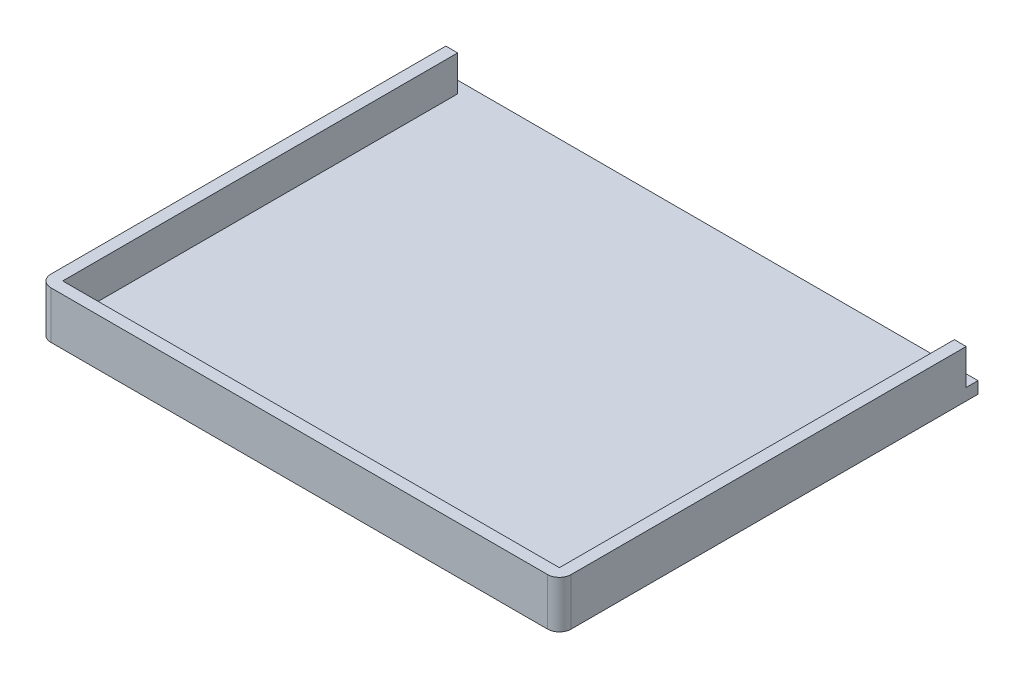
from build123d import *

# Parameters (mm, degrees)
SKETCH1_W           = 220
SKETCH1_H           = 177
BOSS_EXTRUDE1_DEPTH = 5
FILLET1_R           = 5
BOSS_EXTRUDE2_START = 15
BOSS_EXTRUDE2_DEPTH = 15


with BuildPart() as part:
    # Sketch1 → Boss-Extrude1 (new body)
    with BuildSketch(Plane(origin=(0, 0, 0), x_dir=(1, 0, 0), z_dir=(0, 1, 0))):
        Rectangle(SKETCH1_W, SKETCH1_H)
    extrude(amount=BOSS_EXTRUDE1_DEPTH)

    # Fillet1
    fillet1_edges = [part.edges().sort_by_distance(p)[0] for p in [
        (110, 2.5, 88.5),
        (-110, 2.5, 88.5),
    ]]
    fillet(fillet1_edges, radius=FILLET1_R)

    # Sketch3 → Boss-Extrude2 (add)
    with BuildSketch(Plane(origin=(0, 5, 0), x_dir=(1, 0, 0), z_dir=(0, 1, 0)).offset(BOSS_EXTRUDE2_START)):
        with BuildLine():
            Line((-105, 83.5), (-105, -83.5))
            Line((-105, -83.5), (105, -83.5))
            Line((105, -83.5), (105, 83.5))
            Line((105, 83.5), (110, 83.5))
            Line((110, 83.5), (110, -83.5))
            ThreePointArc((110, -83.5), (108.535533906, -87.035533906), (105, -88.5))
            Line((105, -88.5), (-105, -88.5))
            ThreePointArc((-105, -88.5), (-108.535533906, -87.035533906), (-110, -83.5))
            Line((-110, -83.5), (-110, 83.5))
            Line((-110, 83.5), (-105, 83.5))
        make_face()
    extrude(amount=-BOSS_EXTRUDE2_DEPTH)


solid = part.part
